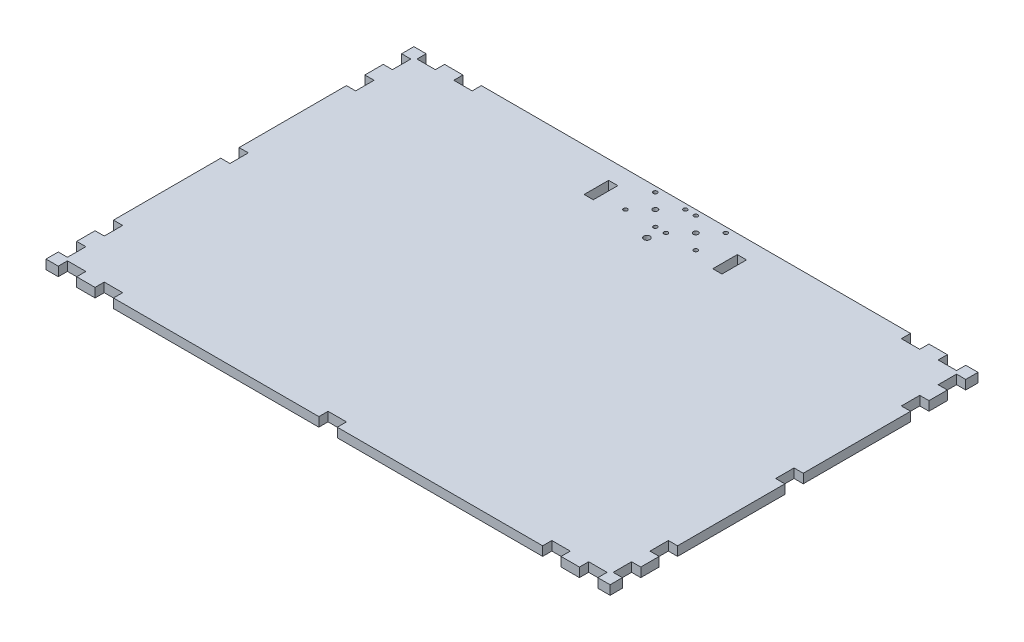
from build123d import *

# Parameters (mm, degrees)
SKETCH1_W           = 584.2
SKETCH1_H           = 381
BOSS_EXTRUDE1_DEPTH = 9.525
SKETCH2_W           = 9.525
SKETCH2_H           = 19.05
SKETCH2_W_2         = 19.05
SKETCH2_H_2         = 9.525
CUT_EXTRUDE1_DEPTH  = 698.525172037
SKETCH3_R           = 2.032
SKETCH3_R_2         = 2.54
SKETCH3_R_3         = 3.175
SKETCH3_W           = 9.525
SKETCH3_H           = 25.4
CUT_EXTRUDE2_DEPTH  = 698.525172037


with BuildPart() as part:
    # Sketch1 → Boss-Extrude1 (new body)
    with BuildSketch(Plane(origin=(0, 0, 0), x_dir=(1, 0, 0), z_dir=(0, 1, 0))):
        with Locations((292.1, 190.5)):
            Rectangle(SKETCH1_W, SKETCH1_H)
    extrude(amount=BOSS_EXTRUDE1_DEPTH)

    # Sketch2 → Cut-Extrude1 (cut, through all)
    with BuildSketch(Plane(origin=(0, 9.525, 0), x_dir=(1, 0, 0), z_dir=(0, 1, 0))):
        with Locations((4.7625, 358.775)):
            Rectangle(SKETCH2_W, SKETCH2_H)
        with Locations((22.225, 376.2375)):
            Rectangle(SKETCH2_W_2, SKETCH2_H_2)
        with Locations((561.975, 376.2375)):
            Rectangle(SKETCH2_W_2, SKETCH2_H_2)
        with Locations((579.4375, 358.775)):
            Rectangle(SKETCH2_W, SKETCH2_H)
        with Locations((579.4375, 22.225)):
            Rectangle(SKETCH2_W, SKETCH2_H)
        with Locations((561.975, 4.7625)):
            Rectangle(SKETCH2_W_2, SKETCH2_H_2)
        with Locations((4.7625, 22.225)):
            Rectangle(SKETCH2_W, SKETCH2_H)
        with Locations((22.225, 4.7625)):
            Rectangle(SKETCH2_W_2, SKETCH2_H_2)
        with Locations((292.1, 4.7625)):
            Rectangle(SKETCH2_W_2, SKETCH2_H_2)
        with Locations((4.7625, 190.5)):
            Rectangle(SKETCH2_W, SKETCH2_H)
        with Locations((579.4375, 190.5)):
            Rectangle(SKETCH2_W, SKETCH2_H)
        with Locations((60.325, 376.2375)):
            Rectangle(SKETCH2_W_2, SKETCH2_H_2)
        with Locations((4.7625, 320.675)):
            Rectangle(SKETCH2_W, SKETCH2_H)
        with Locations((523.875, 376.2375)):
            Rectangle(SKETCH2_W_2, SKETCH2_H_2)
        with Locations((579.4375, 320.675)):
            Rectangle(SKETCH2_W, SKETCH2_H)
        with Locations((579.4375, 60.325)):
            Rectangle(SKETCH2_W, SKETCH2_H)
        with Locations((523.875, 4.7625)):
            Rectangle(SKETCH2_W_2, SKETCH2_H_2)
        with Locations((4.7625, 60.325)):
            Rectangle(SKETCH2_W, SKETCH2_H)
        with Locations((60.325, 4.7625)):
            Rectangle(SKETCH2_W_2, SKETCH2_H_2)
    extrude(amount=-CUT_EXTRUDE1_DEPTH, mode=Mode.SUBTRACT)

    # Sketch3 → Cut-Extrude2 (cut, through all)
    with BuildSketch(Plane(origin=(0, 9.525, 0), x_dir=(1, 0, 0), z_dir=(0, 1, 0))):
        with Locations(Location((255.651, 375.412, 0), (0, 0, 270))):
            Circle(SKETCH3_R)
        with Locations(Location((328.549, 375.412, 0), (0, 0, 270))):
            Circle(SKETCH3_R)
        with Locations(Location((286.639, 375.412, 0), (0, 0, 270))):
            Circle(SKETCH3_R)
        with Locations(Location((297.561, 375.412, 0), (0, 0, 270))):
            Circle(SKETCH3_R)
        with Locations(Location((255.651, 344.424, 0), (0, 0, 270))):
            Circle(SKETCH3_R)
        with Locations(Location((286.639, 344.424, 0), (0, 0, 270))):
            Circle(SKETCH3_R)
        with Locations(Location((297.561, 344.424, 0), (0, 0, 270))):
            Circle(SKETCH3_R)
        with Locations(Location((328.549, 344.424, 0), (0, 0, 270))):
            Circle(SKETCH3_R)
        with Locations(Location((271.145, 359.918, 0), (0, 0, 270))):
            Circle(SKETCH3_R_2)
        with Locations(Location((313.055, 359.918, 0), (0, 0, 270))):
            Circle(SKETCH3_R_2)
        with Locations(Location((292.1, 330.2, 0), (0, 0, 270))):
            Circle(SKETCH3_R_3)
        with Locations((358.7115, 349.25)):
            Rectangle(SKETCH3_W, SKETCH3_H)
        with Locations((225.4885, 349.25)):
            Rectangle(SKETCH3_W, SKETCH3_H)
    extrude(amount=-CUT_EXTRUDE2_DEPTH, mode=Mode.SUBTRACT)


solid = part.part
